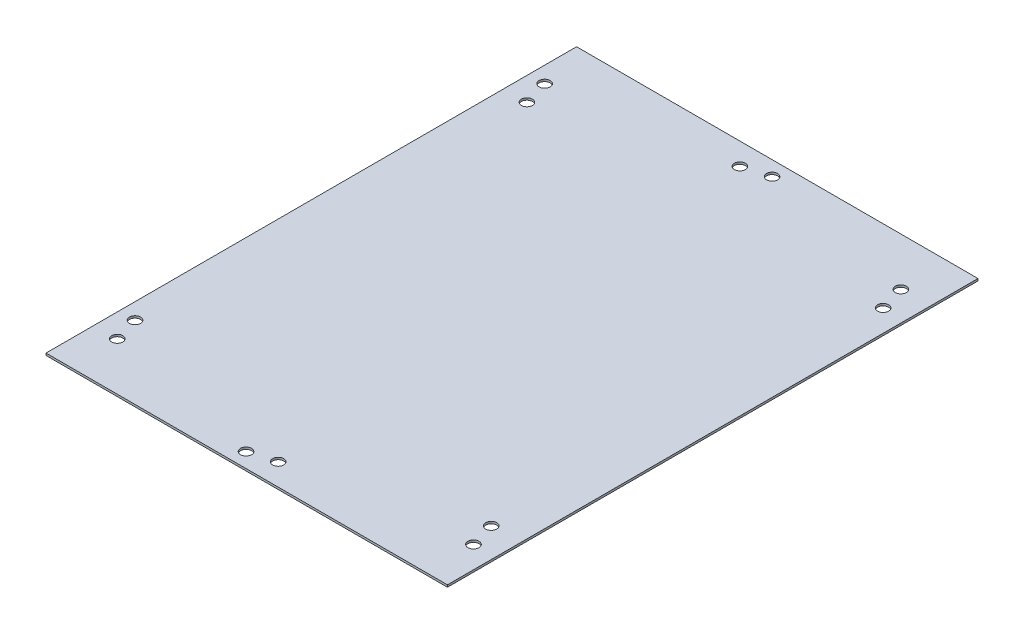
from build123d import *

# Parameters (mm, degrees)
SKETCH3_W           = 245
SKETCH3_H           = 323.8
BOSS_EXTRUDE1_DEPTH = 1.2954
CUT_EXTRUDE1_REACH  = 205.026
SKETCH4_R           = 3.3782


with BuildPart() as part:
    # Sketch3 → Boss-Extrude1 (new body)
    with BuildSketch(Plane(origin=(0, 0, 0), x_dir=(1, 0, 0), z_dir=(0, 1, 0))):
        Rectangle(SKETCH3_W, SKETCH3_H)
    extrude(amount=BOSS_EXTRUDE1_DEPTH)

    # Sketch4 → Cut-Extrude1 (cut, up to next)
    with BuildSketch(Plane(origin=(0, 1.2954, 0), x_dir=(1, 0, 0), z_dir=(0, 1, 0)), mode=Mode.PRIVATE) as cut_extrude1_sk1:
        with Locations(Location((109.1046, -132.62, 0), (0, 0, 270))):
            Circle(SKETCH4_R)
    cut_extrude1_tool1 = extrude(cut_extrude1_sk1.sketch, amount=-CUT_EXTRUDE1_REACH, mode=Mode.PRIVATE) & part.part
    # Sketch4 → Cut-Extrude1 (cut, up to next)
    with BuildSketch(Plane(origin=(0, 1.2954, 0), x_dir=(1, 0, 0), z_dir=(0, 1, 0)), mode=Mode.PRIVATE) as cut_extrude1_sk2:
        with Locations(Location((104.7046, -117.38, 0), (0, 0, 270))):
            Circle(SKETCH4_R)
    cut_extrude1_tool2 = extrude(cut_extrude1_sk2.sketch, amount=-CUT_EXTRUDE1_REACH, mode=Mode.PRIVATE) & part.part
    # Sketch4 → Cut-Extrude1 (cut, up to next)
    with BuildSketch(Plane(origin=(0, 1.2954, 0), x_dir=(1, 0, 0), z_dir=(0, 1, 0)), mode=Mode.PRIVATE) as cut_extrude1_sk3:
        with Locations(Location((5.8246, -148.5, 0), (0, 0, 270))):
            Circle(SKETCH4_R)
    cut_extrude1_tool3 = extrude(cut_extrude1_sk3.sketch, amount=-CUT_EXTRUDE1_REACH, mode=Mode.PRIVATE) & part.part
    # Sketch4 → Cut-Extrude1 (cut, up to next)
    with BuildSketch(Plane(origin=(0, 1.2954, 0), x_dir=(1, 0, 0), z_dir=(0, 1, 0)), mode=Mode.PRIVATE) as cut_extrude1_sk4:
        with Locations(Location((-9.4154, -152.9, 0), (0, 0, 270))):
            Circle(SKETCH4_R)
    cut_extrude1_tool4 = extrude(cut_extrude1_sk4.sketch, amount=-CUT_EXTRUDE1_REACH, mode=Mode.PRIVATE) & part.part
    # Sketch4 → Cut-Extrude1 (cut, up to next)
    with BuildSketch(Plane(origin=(0, 1.2954, 0), x_dir=(1, 0, 0), z_dir=(0, 1, 0)), mode=Mode.PRIVATE) as cut_extrude1_sk5:
        with Locations(Location((109.1046, 117.38, 0), (0, 0, 270))):
            Circle(SKETCH4_R)
    cut_extrude1_tool5 = extrude(cut_extrude1_sk5.sketch, amount=-CUT_EXTRUDE1_REACH, mode=Mode.PRIVATE) & part.part
    # Sketch4 → Cut-Extrude1 (cut, up to next)
    with BuildSketch(Plane(origin=(0, 1.2954, 0), x_dir=(1, 0, 0), z_dir=(0, 1, 0)), mode=Mode.PRIVATE) as cut_extrude1_sk6:
        with Locations(Location((104.7046, 132.62, 0), (0, 0, 270))):
            Circle(SKETCH4_R)
    cut_extrude1_tool6 = extrude(cut_extrude1_sk6.sketch, amount=-CUT_EXTRUDE1_REACH, mode=Mode.PRIVATE) & part.part
    # Sketch4 → Cut-Extrude1 (cut, up to next)
    with BuildSketch(Plane(origin=(0, 1.2954, 0), x_dir=(1, 0, 0), z_dir=(0, 1, 0)), mode=Mode.PRIVATE) as cut_extrude1_sk7:
        with Locations(Location((5.8246, 152.9, 0), (0, 0, 270))):
            Circle(SKETCH4_R)
    cut_extrude1_tool7 = extrude(cut_extrude1_sk7.sketch, amount=-CUT_EXTRUDE1_REACH, mode=Mode.PRIVATE) & part.part
    # Sketch4 → Cut-Extrude1 (cut, up to next)
    with BuildSketch(Plane(origin=(0, 1.2954, 0), x_dir=(1, 0, 0), z_dir=(0, 1, 0)), mode=Mode.PRIVATE) as cut_extrude1_sk8:
        with Locations(Location((-9.4154, 148.5, 0), (0, 0, 270))):
            Circle(SKETCH4_R)
    cut_extrude1_tool8 = extrude(cut_extrude1_sk8.sketch, amount=-CUT_EXTRUDE1_REACH, mode=Mode.PRIVATE) & part.part
    # Sketch4 → Cut-Extrude1 (cut, up to next)
    with BuildSketch(Plane(origin=(0, 1.2954, 0), x_dir=(1, 0, 0), z_dir=(0, 1, 0)), mode=Mode.PRIVATE) as cut_extrude1_sk9:
        with Locations(Location((-108.2954, 117.38, 0), (0, 0, 270))):
            Circle(SKETCH4_R)
    cut_extrude1_tool9 = extrude(cut_extrude1_sk9.sketch, amount=-CUT_EXTRUDE1_REACH, mode=Mode.PRIVATE) & part.part
    # Sketch4 → Cut-Extrude1 (cut, up to next)
    with BuildSketch(Plane(origin=(0, 1.2954, 0), x_dir=(1, 0, 0), z_dir=(0, 1, 0)), mode=Mode.PRIVATE) as cut_extrude1_sk10:
        with Locations(Location((-112.6954, 132.62, 0), (0, 0, 270))):
            Circle(SKETCH4_R)
    cut_extrude1_tool10 = extrude(cut_extrude1_sk10.sketch, amount=-CUT_EXTRUDE1_REACH, mode=Mode.PRIVATE) & part.part
    # Sketch4 → Cut-Extrude1 (cut, up to next)
    with BuildSketch(Plane(origin=(0, 1.2954, 0), x_dir=(1, 0, 0), z_dir=(0, 1, 0)), mode=Mode.PRIVATE) as cut_extrude1_sk11:
        with Locations(Location((-108.2954, -132.62, 0), (0, 0, 270))):
            Circle(SKETCH4_R)
    cut_extrude1_tool11 = extrude(cut_extrude1_sk11.sketch, amount=-CUT_EXTRUDE1_REACH, mode=Mode.PRIVATE) & part.part
    # Sketch4 → Cut-Extrude1 (cut, up to next)
    with BuildSketch(Plane(origin=(0, 1.2954, 0), x_dir=(1, 0, 0), z_dir=(0, 1, 0)), mode=Mode.PRIVATE) as cut_extrude1_sk12:
        with Locations(Location((-112.6954, -117.38, 0), (0, 0, 270))):
            Circle(SKETCH4_R)
    cut_extrude1_tool12 = extrude(cut_extrude1_sk12.sketch, amount=-CUT_EXTRUDE1_REACH, mode=Mode.PRIVATE) & part.part
    add(cut_extrude1_tool1.solids().sort_by_distance((109.1046, 1.2954, 132.62))[0], mode=Mode.SUBTRACT)
    add(cut_extrude1_tool2.solids().sort_by_distance((104.7046, 1.2954, 117.38))[0], mode=Mode.SUBTRACT)
    add(cut_extrude1_tool3.solids().sort_by_distance((5.8246, 1.2954, 148.5))[0], mode=Mode.SUBTRACT)
    add(cut_extrude1_tool4.solids().sort_by_distance((-9.4154, 1.2954, 152.9))[0], mode=Mode.SUBTRACT)
    add(cut_extrude1_tool5.solids().sort_by_distance((109.1046, 1.2954, -117.38))[0], mode=Mode.SUBTRACT)
    add(cut_extrude1_tool6.solids().sort_by_distance((104.7046, 1.2954, -132.62))[0], mode=Mode.SUBTRACT)
    add(cut_extrude1_tool7.solids().sort_by_distance((5.8246, 1.2954, -152.9))[0], mode=Mode.SUBTRACT)
    add(cut_extrude1_tool8.solids().sort_by_distance((-9.4154, 1.2954, -148.5))[0], mode=Mode.SUBTRACT)
    add(cut_extrude1_tool9.solids().sort_by_distance((-108.2954, 1.2954, -117.38))[0], mode=Mode.SUBTRACT)
    add(cut_extrude1_tool10.solids().sort_by_distance((-112.6954, 1.2954, -132.62))[0], mode=Mode.SUBTRACT)
    add(cut_extrude1_tool11.solids().sort_by_distance((-108.2954, 1.2954, 132.62))[0], mode=Mode.SUBTRACT)
    add(cut_extrude1_tool12.solids().sort_by_distance((-112.6954, 1.2954, 117.38))[0], mode=Mode.SUBTRACT)


solid = part.part
